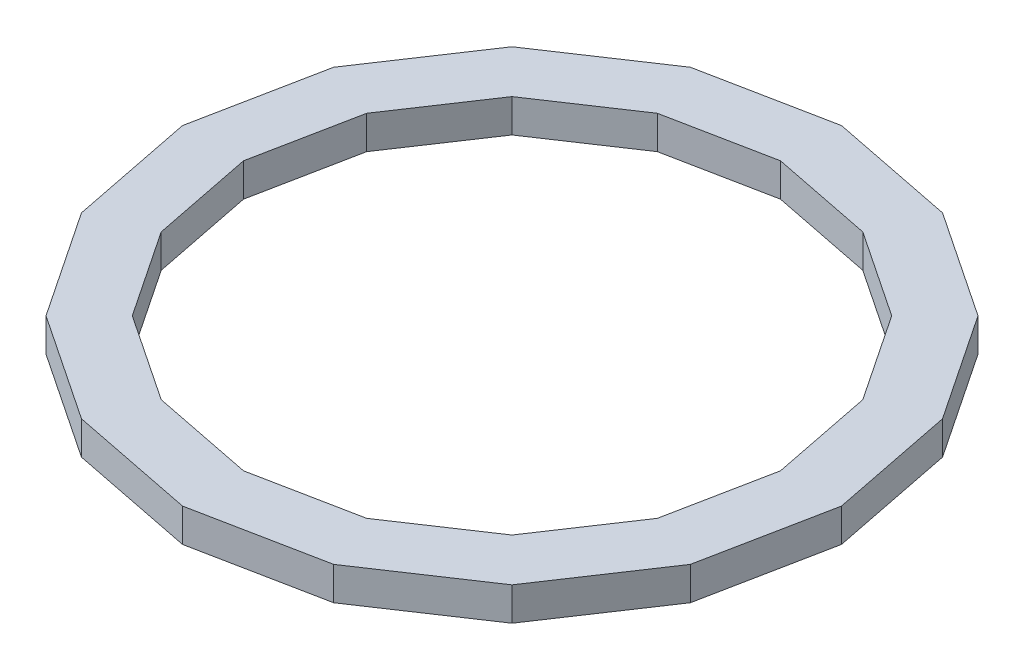
from build123d import *

# Parameters (mm, degrees)
BOSS_EXTRUDE1_DEPTH = 19.05


with BuildPart() as part:
    # Sketch1 → Boss-Extrude1 (new body)
    with BuildSketch(Plane(origin=(0, 0, 0), x_dir=(1, 0, 0), z_dir=(0, 1, 0))):
        Polygon((188.784351881, 0), (174.413998761, 72.244643755), (133.490695397, 133.490695397), (72.244643754, 174.413998761), (0, 188.784351881), (-72.244643755, 174.413998761), (-133.490695397, 133.490695397), (-174.413998761, 72.244643754), (-188.784351881, 0), (-174.413998761, -72.244643755), (-133.490695397, -133.490695397), (-72.244643754, -174.413998761), (0, -188.784351881), (72.244643755, -174.413998761), (133.490695397, -133.490695397), (174.413998761, -72.244643755), align=None)
        Polygon((153.822571066, 0), (142.113525046, 58.865349471), (108.7689831, 108.7689831), (58.865349471, 142.113525046), (0, 153.822571066), (-58.865349471, 142.113525046), (-108.7689831, 108.7689831), (-142.113525046, 58.865349471), (-153.822571066, 0), (-142.113525046, -58.865349471), (-108.7689831, -108.7689831), (-58.865349471, -142.113525046), (0, -153.822571066), (58.865349471, -142.113525046), (108.7689831, -108.7689831), (142.113525046, -58.865349471), align=None, mode=Mode.SUBTRACT)
    extrude(amount=BOSS_EXTRUDE1_DEPTH)


solid = part.part
